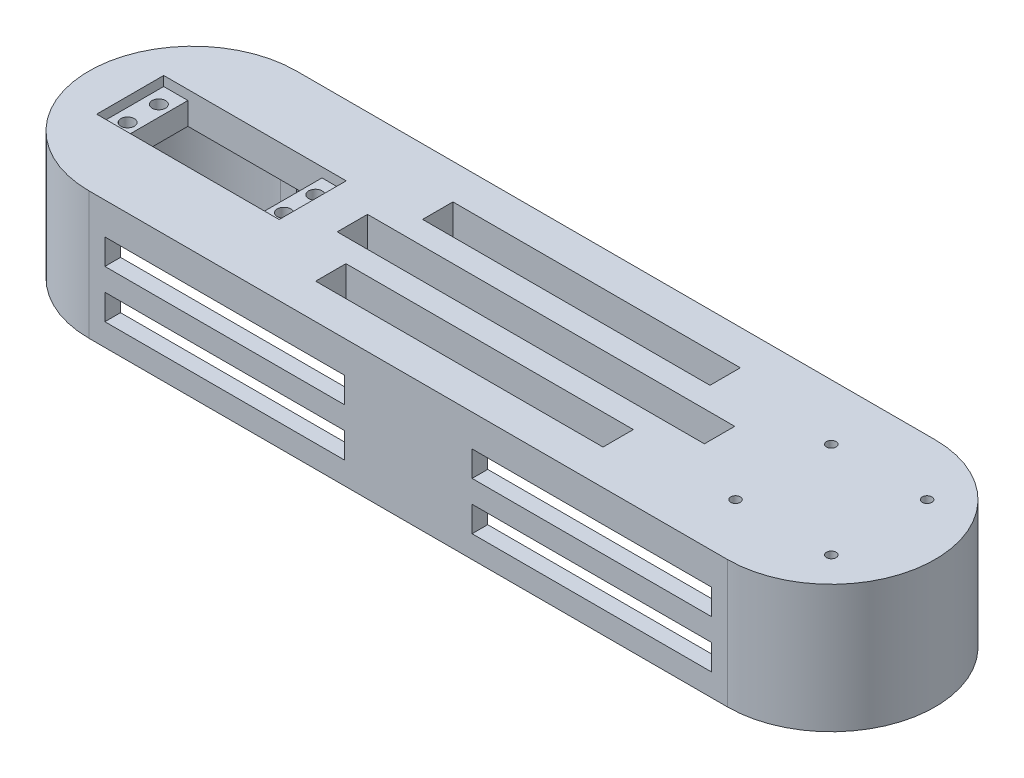
from build123d import *

# Parameters (mm, degrees)
SKETCH1_R           = 2.1
SKETCH1_R_2         = 1.5
SKETCH1_W           = 42
SKETCH1_H           = 21
BOSS_EXTRUDE1_DEPTH = 10
BOSS_EXTRUDE2_START = -30
BOSS_EXTRUDE2_DEPTH = 30
SKETCH3_W           = 75
SKETCH3_H           = 8
CUT_EXTRUDE1_DEPTH  = 45
SKETCH4_W           = 7.58
SKETCH4_H           = 21
CUT_EXTRUDE2_DEPTH  = 3


with BuildPart() as part:
    # Sketch1 → Boss-Extrude1 (new body)
    with BuildSketch(Plane(origin=(0, 0, 0), x_dir=(1, 0, 0), z_dir=(0, 1, 0))):
        with BuildLine():
            Line((-100, 32.5), (100, 32.5))
            ThreePointArc((100, 32.5), (132.5, 0), (100, -32.5))
            Line((100, -32.5), (-100, -32.5))
            ThreePointArc((-100, -32.5), (-132.5, 0), (-100, 32.5))
        make_face()
        with Locations(Location((-115.5, 4.9, 0), (0, 0, 270))):
            Circle(SKETCH1_R, mode=Mode.SUBTRACT)
        with Locations(Location((-115.5, -4.9, 0), (0, 0, 270))):
            Circle(SKETCH1_R, mode=Mode.SUBTRACT)
        with Locations(Location((-66.5, -4.9, 0), (0, 0, 270))):
            Circle(SKETCH1_R, mode=Mode.SUBTRACT)
        with Locations(Location((-66.5, 4.9, 0), (0, 0, 270))):
            Circle(SKETCH1_R, mode=Mode.SUBTRACT)
        with Locations(Location((85, 15, 0), (0, 0, 270))):
            Circle(SKETCH1_R_2, mode=Mode.SUBTRACT)
        with Locations(Location((115, 15, 0), (0, 0, 90))):
            Circle(SKETCH1_R_2, mode=Mode.SUBTRACT)
        with Locations(Location((85, -15, 0), (0, 0, 90))):
            Circle(SKETCH1_R_2, mode=Mode.SUBTRACT)
        with Locations(Location((115, -15, 0), (0, 0, 270))):
            Circle(SKETCH1_R_2, mode=Mode.SUBTRACT)
        with Locations((-91, 0)):
            Rectangle(SKETCH1_W, SKETCH1_H, mode=Mode.SUBTRACT)
        Polygon((0, 21.5), (-40, 21.5), (-40, 12), (0, 12), (50, 12), (50, 21.5), align=None, mode=Mode.SUBTRACT)
        Polygon((-50, 4.75), (0, 4.75), (65, 4.75), (65, -4.75), (0, -4.75), (-50, -4.75), align=None, mode=Mode.SUBTRACT)
        Polygon((0, -12), (-40, -12), (-40, -21.5), (0, -21.5), (50, -21.5), (50, -12), align=None, mode=Mode.SUBTRACT)
    extrude(amount=BOSS_EXTRUDE1_DEPTH)

    # Sketch2 → Boss-Extrude2 (add)
    with BuildSketch(Plane(origin=(0, 0, 0), x_dir=(1, 0, 0), z_dir=(0, 1, 0)).offset(BOSS_EXTRUDE2_START)):
        with BuildLine():
            Line((-100, 32.5), (100, 32.5))
            ThreePointArc((100, 32.5), (132.5, 0), (100, -32.5))
            Line((100, -32.5), (-100, -32.5))
            ThreePointArc((-100, -32.5), (-132.5, 0), (-100, 32.5))
        make_face()
        with BuildLine():
            Line((99.668543355, 27.510998447), (-100, 27.510998447))
            ThreePointArc((-100, 27.510998447), (-127.55585262, -0.044854173), (-100, -27.600706793))
            Line((-100, -27.600706793), (100.998461852, -27.600706793))
            ThreePointArc((100.998461852, -27.600706793), (128.562336478, 0.636345006), (99.668543355, 27.510998447))
        make_face(mode=Mode.SUBTRACT)
    extrude(amount=BOSS_EXTRUDE2_DEPTH)

    # Sketch3 → Cut-Extrude1 (cut, symmetric)
    with BuildSketch(Plane.XY):
        with Locations((-57.5, -19)):
            Rectangle(SKETCH3_W, SKETCH3_H)
        with Locations((57.5, -19)):
            Rectangle(SKETCH3_W, SKETCH3_H)
        with Locations((57.5, -4)):
            Rectangle(SKETCH3_W, SKETCH3_H)
        with Locations((-57.5, -4)):
            Rectangle(SKETCH3_W, SKETCH3_H)
    extrude(amount=CUT_EXTRUDE1_DEPTH, both=True, mode=Mode.SUBTRACT)

    # Sketch4 → Cut-Extrude2 (cut)
    with BuildSketch(Plane(origin=(0, 10, 0), x_dir=(1, 0, 0), z_dir=(0, 1, 0))):
        with Locations((-115.79, 0)):
            Rectangle(SKETCH4_W, SKETCH4_H)
        with Locations((-66.21, 0)):
            Rectangle(SKETCH4_W, SKETCH4_H)
    extrude(amount=-CUT_EXTRUDE2_DEPTH, mode=Mode.SUBTRACT)


solid = part.part
